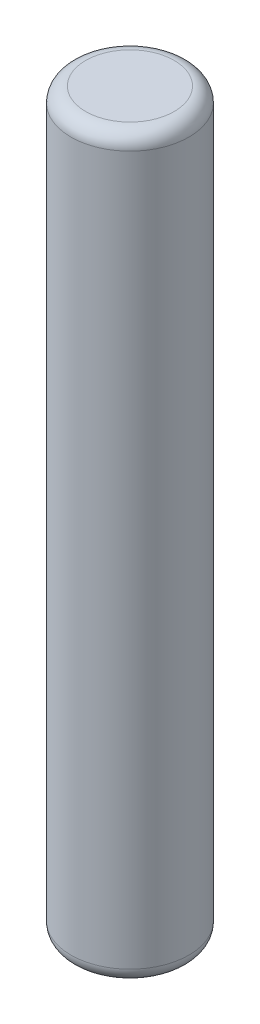
from build123d import *

# Parameters (mm, degrees)
SKETCH1_R           = 4
BOSS_EXTRUDE1_DEPTH = 50
FILLET1_R           = 1
FILLET2_R           = 1
SCALE1_SCALE        = 0.7


with BuildPart() as part:
    # Sketch1 → Boss-Extrude1 (new body)
    with BuildSketch(Plane(origin=(0, 0, 0), x_dir=(1, 0, 0), z_dir=(0, 1, 0))):
        with Locations(Location((0, 0, 0), (0, 0, 270))):
            Circle(SKETCH1_R)
    extrude(amount=BOSS_EXTRUDE1_DEPTH)

    # Fillet1
    fillet1_edges = [part.edges().sort_by_distance(p)[0] for p in [
        (0, 50, -4),
    ]]
    fillet(fillet1_edges, radius=FILLET1_R)

    # Fillet2
    fillet2_edges = [part.edges().sort_by_distance(p)[0] for p in [
        (0, 0, -4),
    ]]
    fillet(fillet2_edges, radius=FILLET2_R)


with BuildPart() as part_1:
    # Scale1: scaled about (0, 25, 0)
    add(part.part.scale(SCALE1_SCALE).moved(Location((0, 7.5, 0))))


solid = part_1.part
